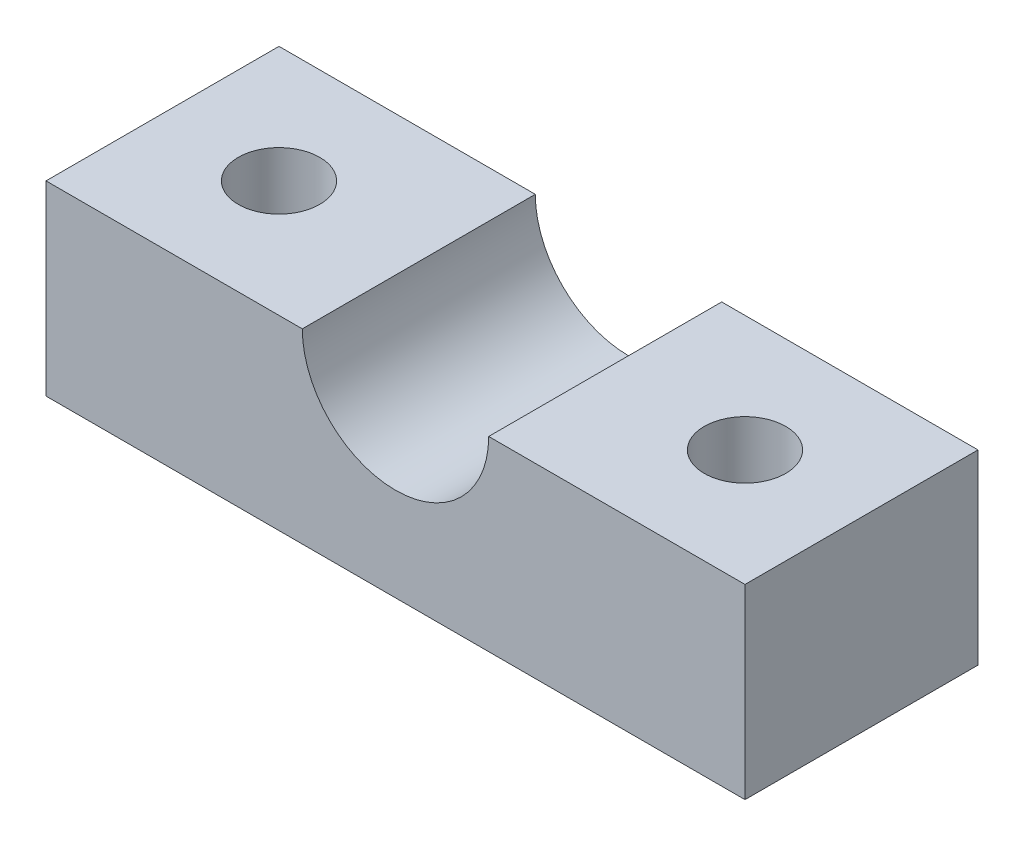
from build123d import *

# Parameters (mm, degrees)
AUFSATZ_LINEAR_AUSTRAGEN1_DEPTH  = 10
F_3_5_3_5_DURCHMESSER_BOHRUNG2_D = 3.5


with BuildPart() as part:
    # Skizze1 → Aufsatz-Linear austragen1 (new body)
    with BuildSketch(Plane.XY):
        with BuildLine():
            Line((19, 8), (30, 8))
            Line((30, 8), (30, 0))
            Line((30, 0), (0, 0))
            Line((0, 0), (0, 8))
            Line((0, 8), (11, 8))
            ThreePointArc((11, 8), (15, 4), (19, 8))
        make_face()
    extrude(amount=AUFSATZ_LINEAR_AUSTRAGEN1_DEPTH)

    # Ø3.5 (3.5) Durchmesser Bohrung2 (through all)
    with Locations(Plane(origin=(0, 0, 0), x_dir=(-1, 0, 0), z_dir=(0, -1, 0))):
        with Locations((-5, -5), (-25, -5)):
            Hole(F_3_5_3_5_DURCHMESSER_BOHRUNG2_D / 2)


solid = part.part
